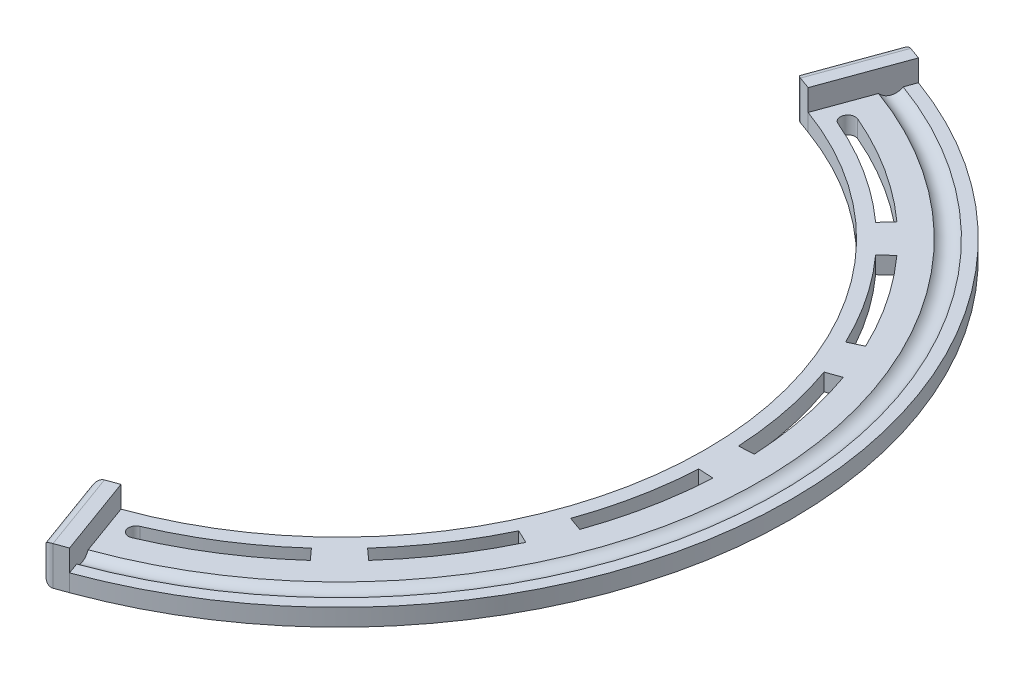
from build123d import *

# Parameters (mm, degrees)
REVOLVE_1_ANGLE     = 140
SKETCH_3_W          = 20
SKETCH_3_H          = 9
EXTRUDE_1_DEPTH     = 5
SKETCH_4_W          = 20
SKETCH_4_H          = 9
EXTRUDE_2_DEPTH     = 5
CUT_EXTRUDE_1_DEPTH = 5
FILLET_1_R          = 2
EXTRUDE_START       = -4
EXTRUDE_3_DEPTH     = 4


with BuildPart() as part:
    # 草图2 → 旋转1 (revolve, symmetric)
    with BuildSketch(Plane.XY) as revolve_1_sk:
        with BuildLine():
            ThreePointArc((102.236067977, -6), (100, -7), (97.763932023, -6))
            Line((97.763932023, -6), (85, -6))
            Line((85, -6), (85, -10))
            Line((85, -10), (105, -10))
            Line((105, -10), (105, -6))
            Line((105, -6), (102.236067977, -6))
        make_face()
    revolve(axis=Axis((0, 24.366902053, 0), (0, -1, 0)), revolution_arc=REVOLVE_1_ANGLE / 2)
    revolve(revolve_1_sk.sketch, axis=Axis((0, 24.366902053, 0), (0, 1, 0)), revolution_arc=REVOLVE_1_ANGLE / 2)

    # 草图3 → 凸台-拉伸1 (add)
    with BuildSketch(Plane(origin=(0, 0, 0), x_dir=(0.34202014332566616, 0, 0.9396926207859094), z_dir=(-0.9396926207859093, 0, 0.3420201433256661))):
        with Locations((95, -5.5)):
            Rectangle(SKETCH_3_W, SKETCH_3_H)
    extrude(amount=EXTRUDE_1_DEPTH)

    # 草图4 → 凸台-拉伸2 (add)
    with BuildSketch(Plane(origin=(0, 0, 0), x_dir=(-0.34202014332566616, 0, 0.9396926207859094), z_dir=(-0.9396926207859094, 0, -0.34202014332566616))):
        with Locations((-95, -5.5)):
            Rectangle(SKETCH_4_W, SKETCH_4_H)
    extrude(amount=EXTRUDE_2_DEPTH)

    # 草图5 → 切除-拉伸1 (cut)
    with BuildSketch(Plane(origin=(0, -6, 0), x_dir=(1, 0, 0), z_dir=(0, 1, 0))):
        with BuildLine():
            ThreePointArc((34.743766956, 81.122950869), (88.25, -6.1e-08), (34.743766843, -81.122950917))
            ThreePointArc((34.743766843, -81.122950917), (33.82406612, -83.420591403), (36.121706789, -84.340291668))
            ThreePointArc((36.121706789, -84.340291668), (91.75, 4e-08), (36.121706715, 84.3402917))
            ThreePointArc((36.121706715, 84.3402917), (33.82406608, 83.42059131), (34.743766956, 81.122950869))
        make_face()
    extrude(amount=-CUT_EXTRUDE_1_DEPTH, mode=Mode.SUBTRACT)

    # 圆角1
    fillet_1_edges = [part.edges().sort_by_distance(p)[0] for p in [
        (24.373249079, -5.5, 81.583973483),
        (31.213651945, -5.5, 100.377825899),
        (27.793450512, -1, 90.980899691),
        (27.793450512, -10, 90.980899691),
        (31.213651945, -5.5, -100.377825899),
        (24.373249079, -5.5, -81.583973483),
        (27.793450512, -1, -90.980899691),
        (27.793450512, -10, -90.980899691),
    ]]
    fillet(fillet_1_edges, radius=FILLET_1_R)

    # 草图6 → 凸台-拉伸3 (add)
    with BuildSketch(Plane.XZ.offset(10).offset(EXTRUDE_START)):
        with BuildLine():
            ThreePointArc((59.050776011, 65.582530848), (62.40217344, 62.40217344), (65.582530848, 59.050776011))
            Line((65.582530848, 59.050776011), (68.183537738, 61.392733133))
            ThreePointArc((68.183537738, 61.392733133), (64.877047174, 64.877047174), (61.392733133, 68.183537738))
            Line((61.392733133, 68.183537738), (59.050776011, 65.582530848))
        make_face()
        with BuildLine():
            ThreePointArc((79.653151344, 37.992604293), (81.532368744, 33.771812906), (83.188111589, 29.458455327))
            Line((83.188111589, 29.458455327), (86.487356808, 30.626779335))
            ThreePointArc((86.487356808, 30.626779335), (84.765947108, 35.111204919), (82.812199839, 39.499393132))
            Line((82.812199839, 39.499393132), (79.653151344, 37.992604293))
        make_face()
        with BuildLine():
            Line((91.624259814, 4.801823985), (88.129056442, 4.618648138))
            ThreePointArc((88.129056442, 4.618648138), (88.219758929, 2.310115688), (88.25, 0))
            ThreePointArc((88.25, 0), (88.219758929, -2.310115688), (88.129056442, -4.618648138))
            Line((88.129056442, -4.618648138), (91.624259814, -4.801823985))
            ThreePointArc((91.624259814, -4.801823985), (91.718559567, -2.401735007), (91.75, 0))
            ThreePointArc((91.75, 0), (91.718559567, 2.401735007), (91.624259814, 4.801823985))
        make_face()
        with BuildLine():
            ThreePointArc((83.188111589, -29.458455327), (81.532368744, -33.771812906), (79.653151344, -37.992604293))
            Line((79.653151344, -37.992604293), (82.812199839, -39.499393132))
            ThreePointArc((82.812199839, -39.499393132), (84.765947108, -35.111204919), (86.487356808, -30.626779335))
            Line((86.487356808, -30.626779335), (83.188111589, -29.458455327))
        make_face()
        with BuildLine():
            ThreePointArc((65.582530848, -59.050776011), (62.40217344, -62.40217344), (59.050776011, -65.582530848))
            Line((59.050776011, -65.582530848), (61.392733133, -68.183537738))
            ThreePointArc((61.392733133, -68.183537738), (64.877047174, -64.877047174), (68.183537738, -61.392733133))
            Line((68.183537738, -61.392733133), (65.582530848, -59.050776011))
        make_face()
    extrude(amount=EXTRUDE_3_DEPTH)


solid = part.part
